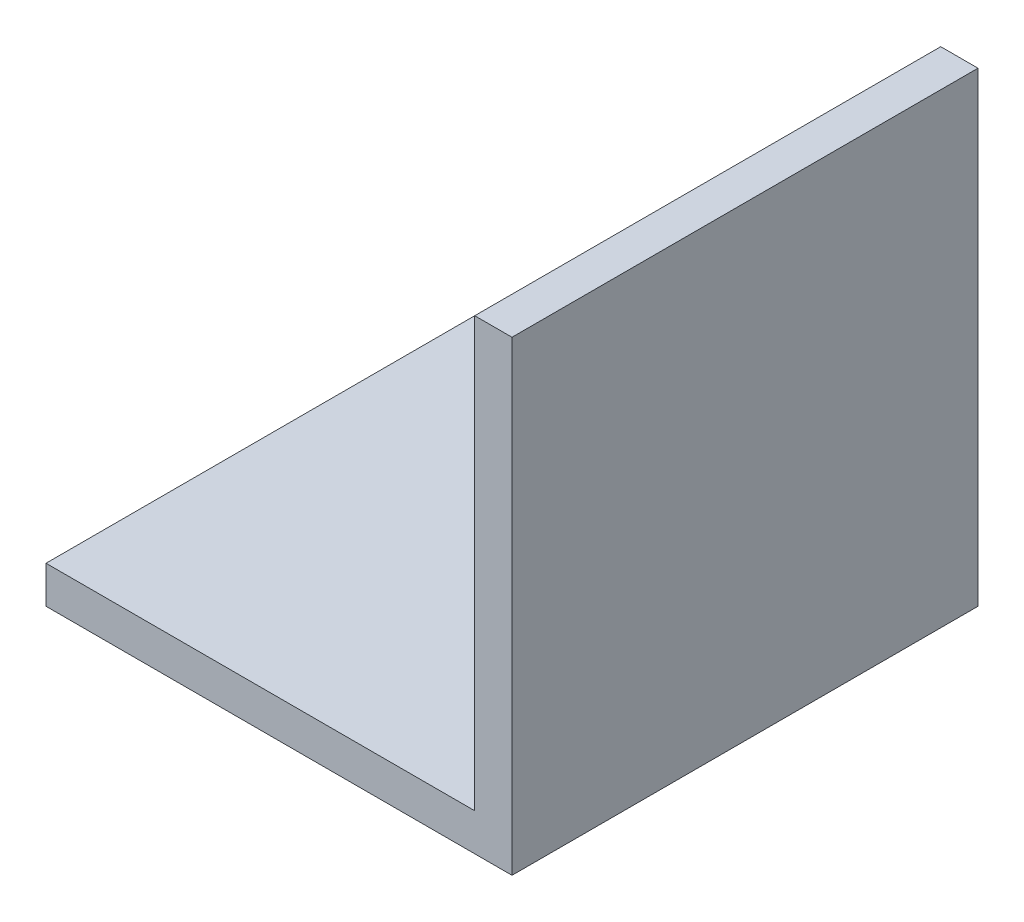
from build123d import *

# Parameters (mm, degrees)
BOSS_EXTRUDE1_DEPTH = 50


with BuildPart() as part:
    # Sketch1 → Boss-Extrude1 (new body)
    with BuildSketch(Plane.XY):
        Polygon((-34.428476147, -7.383612423), (15.571523853, -7.383612423), (15.571523853, 42.616387577), (11.571523853, 42.616387577), (11.571523853, -3.383612423), (-34.428476147, -3.383612423), align=None)
    extrude(amount=BOSS_EXTRUDE1_DEPTH)


solid = part.part
